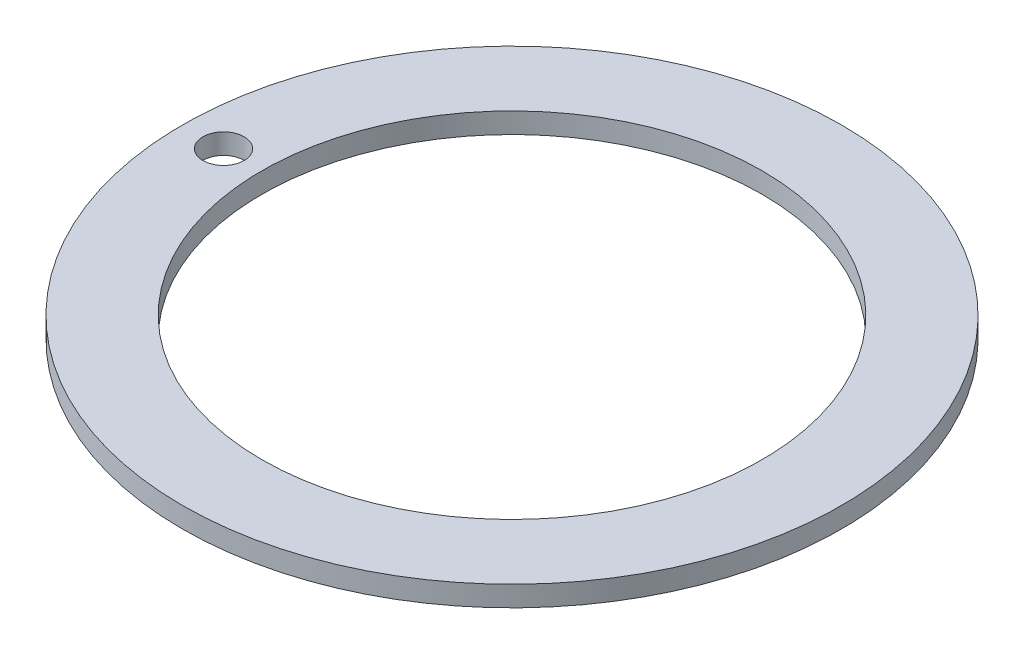
from build123d import *

# Parameters (mm, degrees)
SKETCH1_R           = 38.0746
SKETCH1_R_2         = 28.9052
BOSS_EXTRUDE1_DEPTH = 2.3622
SKETCH2_R           = 2.38125
CUT_EXTRUDE2_DEPTH  = 2.54


with BuildPart() as part:
    # Sketch1 → Boss-Extrude1 (new body)
    with BuildSketch(Plane(origin=(0, 0, 0), x_dir=(1, 0, 0), z_dir=(0, 1, 0))):
        with Locations(Location((0, 0, 0), (0, 0, 270))):
            Circle(SKETCH1_R)
        with Locations(Location((0, 0, 0), (0, 0, 270))):
            Circle(SKETCH1_R_2, mode=Mode.SUBTRACT)
    extrude(amount=BOSS_EXTRUDE1_DEPTH)

    # Sketch2 → Cut-Extrude2 (cut)
    with BuildSketch(Plane(origin=(0, 2.3622, 0), x_dir=(1, 0, 0), z_dir=(0, 1, 0))):
        with Locations(Location((-33.329941143, 0, 0), (0, 0, 270))):
            Circle(SKETCH2_R)
    extrude(amount=-CUT_EXTRUDE2_DEPTH, mode=Mode.SUBTRACT)


solid = part.part
